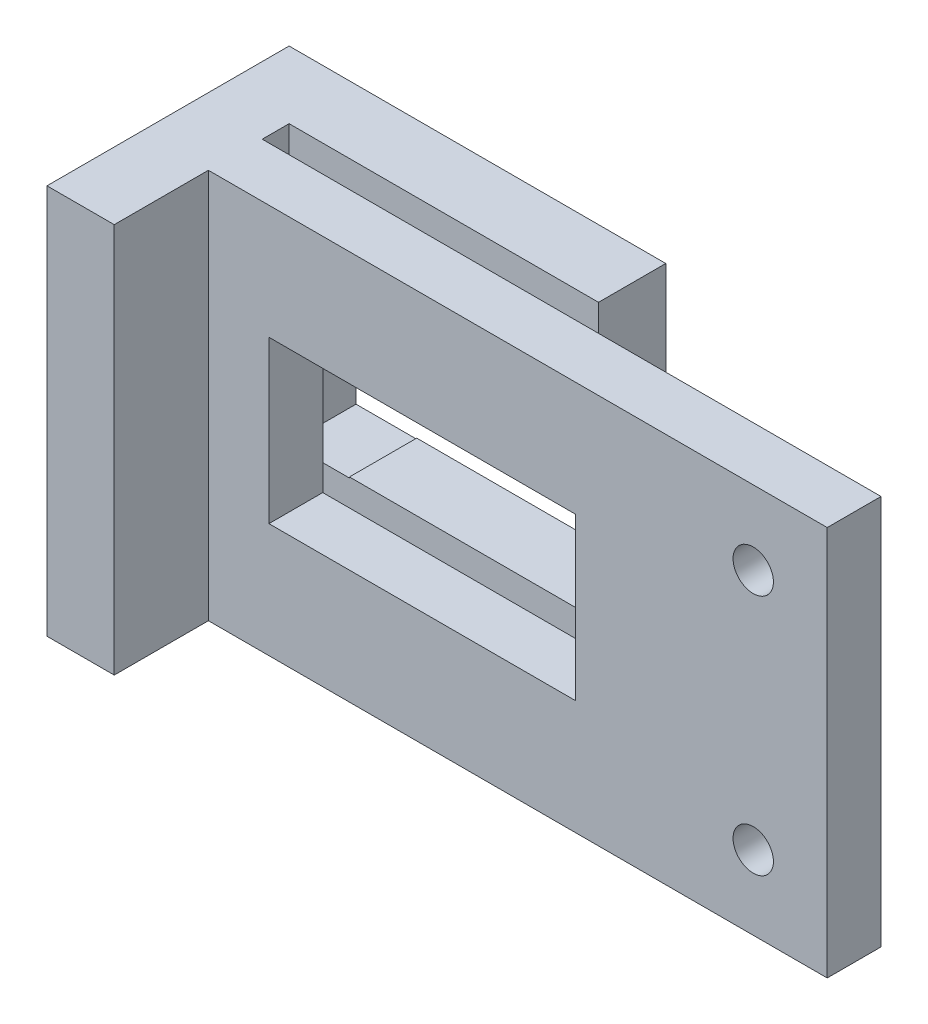
from build123d import *

# Parameters (mm, degrees)
CROQUIS1_W              = 29
CROQUIS1_H              = 46
SALIENTE_EXTRUIR1_DEPTH = 4
CROQUIS2_W              = 5
CROQUIS2_H              = 29
SALIENTE_EXTRUIR2_DEPTH = 7
CROQUIS3_W              = 5
CROQUIS3_H              = 29
SALIENTE_EXTRUIR3_DEPTH = 21
CROQUIS4_W              = 29
CROQUIS4_H              = 15
SALIENTE_EXTRUIR4_DEPTH = 28
CROQUIS5_R              = 1.5
CORTAR_EXTRUIR1_DEPTH   = 28
CROQUIS6_W              = 28
CROQUIS6_H              = 10
CORTAR_EXTRUIR2_DEPTH   = 60
CORTAR_EXTRUIR3_START   = -5
CROQUIS7_W              = 4.510634874
CROQUIS7_H              = 12.04330307
CORTAR_EXTRUIR3_DEPTH   = 60
CORTAR_EXTRUIR4_START   = -5
CROQUIS8_W              = 3.464680309
CROQUIS8_H              = 12
CORTAR_EXTRUIR4_DEPTH   = 60


with BuildPart() as part:
    # Croquis1 → Saliente-Extruir1 (new body)
    with BuildSketch(Plane(origin=(0, 0, 0), x_dir=(0, 1, 0), z_dir=(0, 0, 1))):
        Rectangle(CROQUIS1_W, CROQUIS1_H)
    extrude(amount=SALIENTE_EXTRUIR1_DEPTH)



with BuildPart() as body_2:
    # Croquis2 → Saliente-Extruir2 (new body)
    with BuildSketch(Plane.XY.offset(4)):
        with Locations((-25.5, 0)):
            Rectangle(CROQUIS2_W, CROQUIS2_H)
    extrude(amount=SALIENTE_EXTRUIR2_DEPTH)


with BuildPart() as part_1:
    add(part.part)

    add(body_2.part)  # Saliente-Extruir3 merges body 2
    # Croquis3 → Saliente-Extruir3 (add)
    with BuildSketch(Plane(origin=(0, 0, 4), x_dir=(1, 0, 0), z_dir=(0, 0, -1))):
        with Locations((-25.5, 0)):
            Rectangle(CROQUIS3_W, CROQUIS3_H)
    extrude(amount=SALIENTE_EXTRUIR3_DEPTH)

    # Croquis4 → Saliente-Extruir4 (add)
    with BuildSketch(Plane(origin=(-28, 0, 0), x_dir=(0, -1, 0), z_dir=(-1, 0, 0))):
        with Locations((0, -9.5)):
            Rectangle(CROQUIS4_W, CROQUIS4_H)
    extrude(amount=-SALIENTE_EXTRUIR4_DEPTH)

    # Croquis5 → Cortar-Extruir1 (cut)
    with BuildSketch(Plane.XY.offset(4)):
        with Locations((17.5, -9)):
            Circle(CROQUIS5_R)
        with Locations((17.5, 9)):
            Circle(CROQUIS5_R)
        Polygon((-18.5, 0), (-18.5, -6), (4.3, -6), (4.3, 6), (-18.5, 6), align=None)
    extrude(amount=-CORTAR_EXTRUIR1_DEPTH, mode=Mode.SUBTRACT)

    # Croquis6 → Cortar-Extruir2 (cut)
    with BuildSketch(Plane(origin=(0, 14.5, 0), x_dir=(1, 0, 0), z_dir=(0, 1, 0))):
        with Locations((-14, 12)):
            Rectangle(CROQUIS6_W, CROQUIS6_H)
    extrude(amount=-CORTAR_EXTRUIR2_DEPTH, mode=Mode.SUBTRACT)

    # Croquis7 → Cortar-Extruir3 (cut)
    with BuildSketch(Plane.XY.offset(4).offset(CORTAR_EXTRUIR3_START)):
        with Locations((-20.769799618, -0.048913864)):
            Rectangle(CROQUIS7_W, CROQUIS7_H)
    extrude(amount=-CORTAR_EXTRUIR3_DEPTH, mode=Mode.SUBTRACT)

    # Croquis8 → Cortar-Extruir4 (cut)
    with BuildSketch(Plane.XY.offset(4).offset(CORTAR_EXTRUIR4_START)):
        with Locations((-18.492763456, 0)):
            Rectangle(CROQUIS8_W, CROQUIS8_H)
    extrude(amount=-CORTAR_EXTRUIR4_DEPTH, mode=Mode.SUBTRACT)


solid = part_1.part
